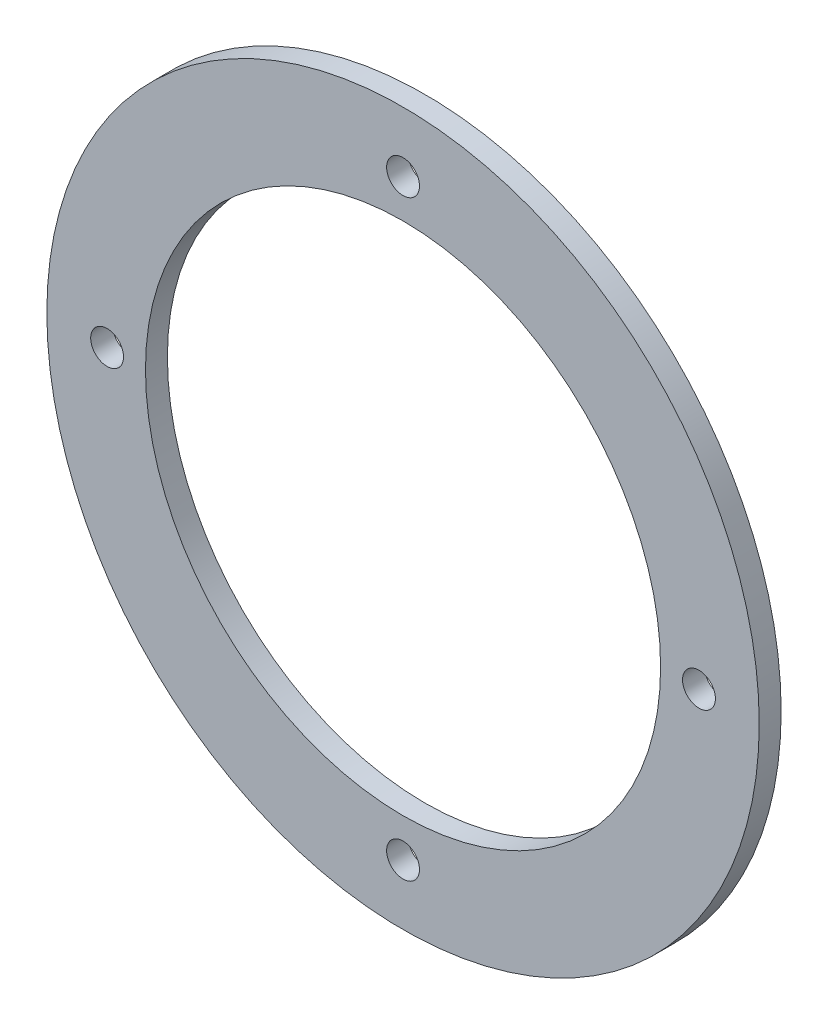
from build123d import *

# Parameters (mm, degrees)
SKETCH1_R           = 32.5
SKETCH1_R_2         = 23.5
SKETCH1_R_3         = 1.5
BOSS_EXTRUDE1_DEPTH = 2


with BuildPart() as part:
    # Sketch1 → Boss-Extrude1 (new body)
    with BuildSketch(Plane.XY):
        Circle(SKETCH1_R)
        Circle(SKETCH1_R_2, mode=Mode.SUBTRACT)
        with Locations((-27, 0)):
            Circle(SKETCH1_R_3, mode=Mode.SUBTRACT)
        with Locations((27, 0)):
            Circle(SKETCH1_R_3, mode=Mode.SUBTRACT)
        with Locations((0, 27)):
            Circle(SKETCH1_R_3, mode=Mode.SUBTRACT)
        with Locations((0, -27)):
            Circle(SKETCH1_R_3, mode=Mode.SUBTRACT)
    extrude(amount=BOSS_EXTRUDE1_DEPTH)


solid = part.part
